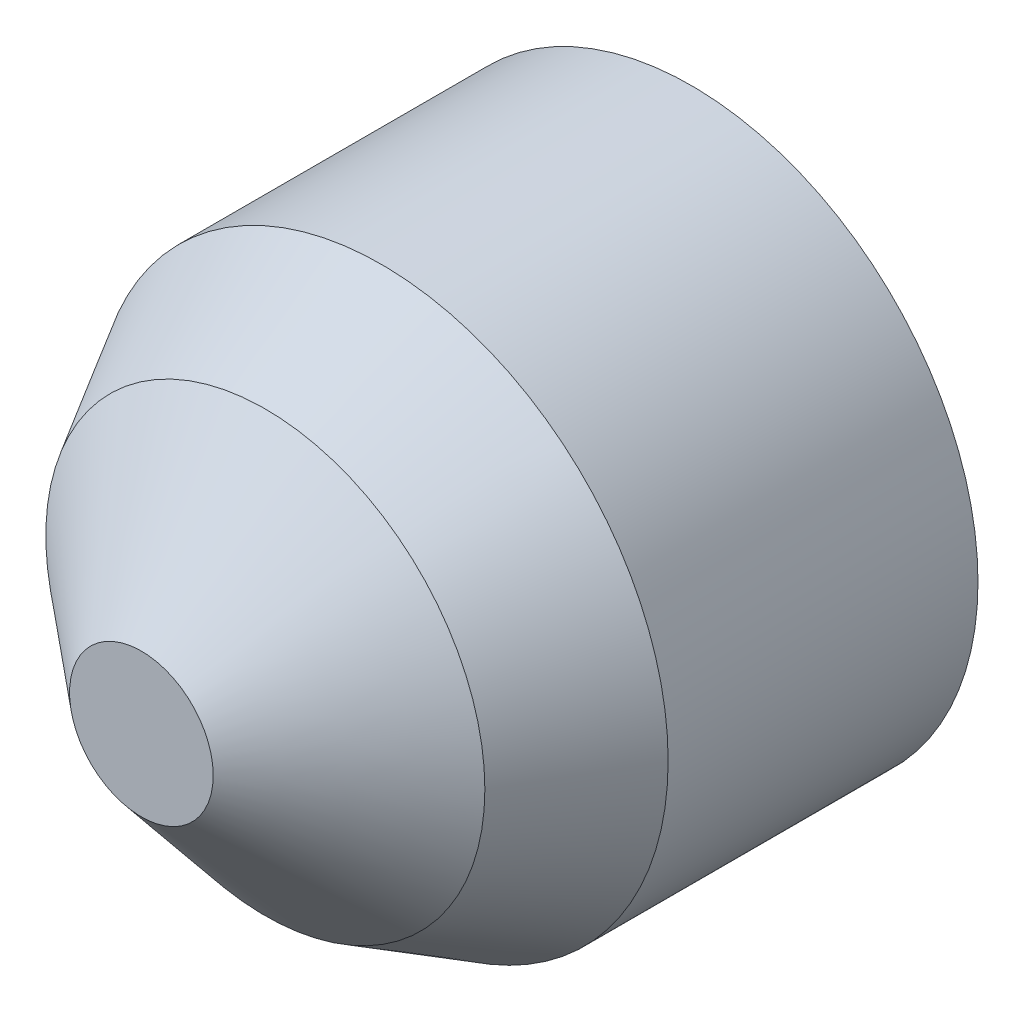
from build123d import *

# Parameters (mm, degrees)
SKETCH1_R           = 7.4
LENS_BODY_DEPTH     = 8
SKETCH2_R           = 7.4
LENS_SHOULDER_DEPTH = 3
LENS_SHOULDER_TAPER = 30
SKETCH3_R           = 5.667949192
LENS_CROWN_DEPTH    = 3.2
LENS_CROWN_TAPER    = 50
SKETCH4_R           = 2.6
LED_CAVITY_DEPTH    = 4.75


with BuildPart() as part:
    # Sketch1 → Lens_body (new body)
    with BuildSketch(Plane.XY):
        Circle(SKETCH1_R)
    extrude(amount=LENS_BODY_DEPTH)

    # Sketch2 → Lens_shoulder (add)
    with BuildSketch(Plane.XY.offset(8)):
        Circle(SKETCH2_R)
    extrude(amount=LENS_SHOULDER_DEPTH, taper=LENS_SHOULDER_TAPER)

    # Sketch3 → Lens_crown (add)
    with BuildSketch(Plane.XY.offset(11)):
        Circle(SKETCH3_R)
    extrude(amount=LENS_CROWN_DEPTH, taper=LENS_CROWN_TAPER)

    # Sketch4 → LED_cavity (cut, symmetric)
    with BuildSketch(Plane.XY.offset(4.25)):
        Circle(SKETCH4_R)
    extrude(amount=LED_CAVITY_DEPTH, both=True, mode=Mode.SUBTRACT)


solid = part.part
